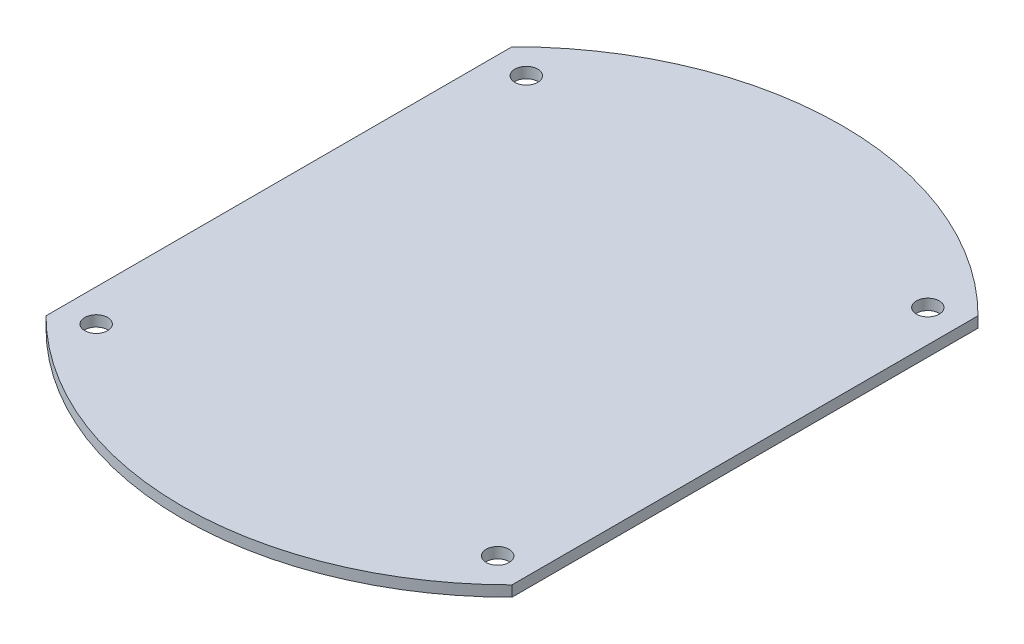
from build123d import *

# Parameters (mm, degrees)
SKETCH_1_W      = 65
SKETCH_1_H      = 65
SKETCH_1_R      = 1.6
EXTRUDE_1_DEPTH = 1.5


with BuildPart() as part:
    # Эскиз1 → Бобышка-Вытянуть1 (new body)
    # profile 1 of 3: a face of its own
    with BuildSketch(Plane(origin=(0, 0, 0), x_dir=(1, 0, 0), z_dir=(0, 1, 0))):
        with BuildLine():
            Line((-32.5, -32.5), (32.5, -32.5))
            ThreePointArc((32.5, -32.5), (0, -46), (-32.5, -32.5))
        make_face()
    # profile 2 of 3: a face of its own
    with BuildSketch(Plane(origin=(0, 0, 0), x_dir=(1, 0, 0), z_dir=(0, 1, 0))):
        Rectangle(SKETCH_1_W, SKETCH_1_H)
        with Locations(Location((-28, -30, 0), (0, 0, 270))):
            Circle(SKETCH_1_R, mode=Mode.SUBTRACT)
        with Locations(Location((-28, 30, 0), (0, 0, 270))):
            Circle(SKETCH_1_R, mode=Mode.SUBTRACT)
        with Locations(Location((28, 30, 0), (0, 0, 270))):
            Circle(SKETCH_1_R, mode=Mode.SUBTRACT)
        with Locations(Location((28, -30, 0), (0, 0, 270))):
            Circle(SKETCH_1_R, mode=Mode.SUBTRACT)
    # profile 3 of 3: a face of its own
    with BuildSketch(Plane(origin=(0, 0, 0), x_dir=(1, 0, 0), z_dir=(0, 1, 0))):
        with BuildLine():
            ThreePointArc((-32.5, 32.5), (0, 46), (32.5, 32.5))
            Line((32.5, 32.5), (-32.5, 32.5))
        make_face()
    extrude(amount=EXTRUDE_1_DEPTH)


solid = part.part
